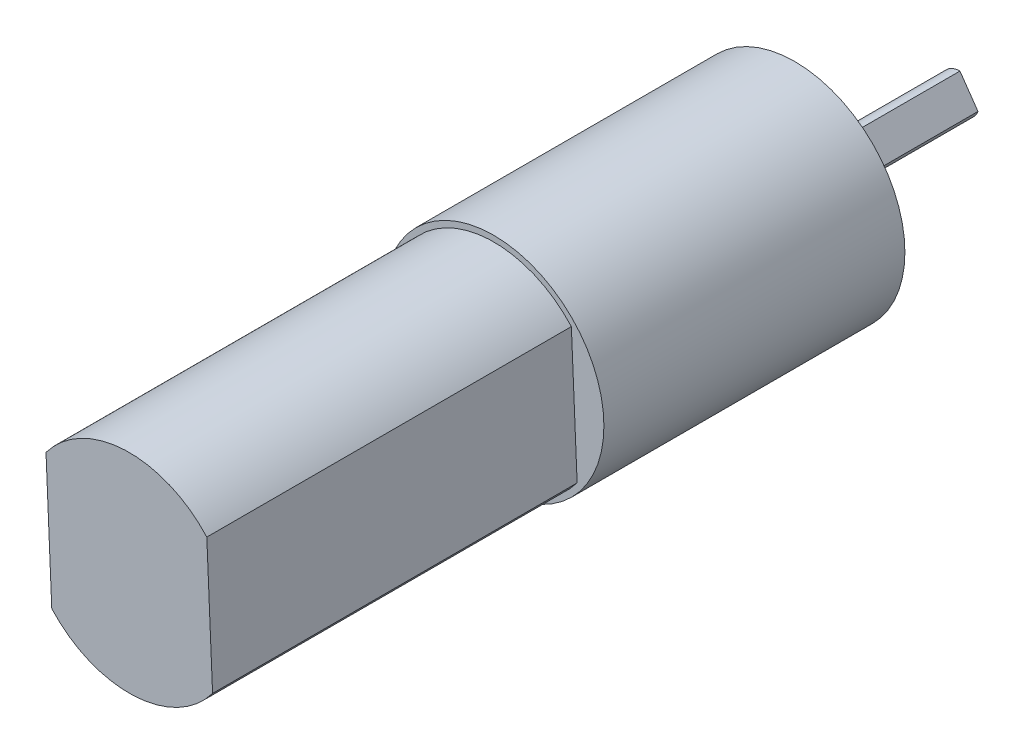
from build123d import *

# Parameters (mm, degrees)
SKETCH1_R                        = 8
BOSS_EXTRUDE1_DEPTH              = 21.88
BOSS_EXTRUDE2_DEPTH              = 26.5
SKETCH3_R                        = 2.835
BOSS_EXTRUDE3_DEPTH              = 2
BOSS_EXTRUDE4_DEPTH              = 10
F_2_05_2_05_DIAMETER_HOLE1_D     = 2.05
F_2_05_2_05_DIAMETER_HOLE1_DEPTH = 3
F_2_05_2_05_DIAMETER_HOLE1_TIP   = 0.615882135


with BuildPart() as part:
    # Sketch1 → Boss-Extrude1 (new body)
    with BuildSketch(Plane.XY):
        Circle(SKETCH1_R)
    extrude(amount=BOSS_EXTRUDE1_DEPTH)

    # Sketch2 → Boss-Extrude2 (add)
    with BuildSketch(Plane.XY.offset(21.88)):
        with BuildLine():
            Line((5.634523633, 5.0703593), (6.054375133, -4.560804945))
            ThreePointArc((6.054375133, -4.560804945), (0.33012154, -7.572807918), (-5.634523633, -5.0703593))
            Line((-5.634523633, -5.0703593), (-6.054375133, 4.560804945))
            ThreePointArc((-6.054375133, 4.560804945), (-0.33012154, 7.572807918), (5.634523633, 5.0703593))
        make_face()
    extrude(amount=BOSS_EXTRUDE2_DEPTH)

    # Sketch3 → Boss-Extrude3 (add)
    with BuildSketch(Plane(origin=(0, 0, 0), x_dir=(-1, 0, 0), z_dir=(0, 0, -1))):
        with Locations(Location((0, 0, 0), (0, 0, 180))):
            Circle(SKETCH3_R)
    extrude(amount=BOSS_EXTRUDE3_DEPTH)

    # Sketch4 → Boss-Extrude4 (add)
    with BuildSketch(Plane(origin=(0, 0, -2), x_dir=(-1, 0, 0), z_dir=(0, 0, -1))):
        with BuildLine():
            Line((0, 1.4), (-1.313042891, -0.485714286))
            ThreePointArc((-1.313042891, -0.485714286), (1.148912529, -0.8), (0, 1.4))
        make_face()
    extrude(amount=BOSS_EXTRUDE4_DEPTH)

    # Ø2.05 (2.05) Diameter Hole1
    with Locations(Plane(origin=(0, 0, 0), x_dir=(-1, 0, 0), z_dir=(0, 0, -1))):
        with Locations((-5.5, 0), (5.5, 0)):
            Hole(F_2_05_2_05_DIAMETER_HOLE1_D / 2, depth=F_2_05_2_05_DIAMETER_HOLE1_DEPTH)
            with Locations((0, 0, -(F_2_05_2_05_DIAMETER_HOLE1_DEPTH + F_2_05_2_05_DIAMETER_HOLE1_TIP / 2))):  # 118° drill point
                Cone(0, F_2_05_2_05_DIAMETER_HOLE1_D / 2, F_2_05_2_05_DIAMETER_HOLE1_TIP, mode=Mode.SUBTRACT)


solid = part.part
